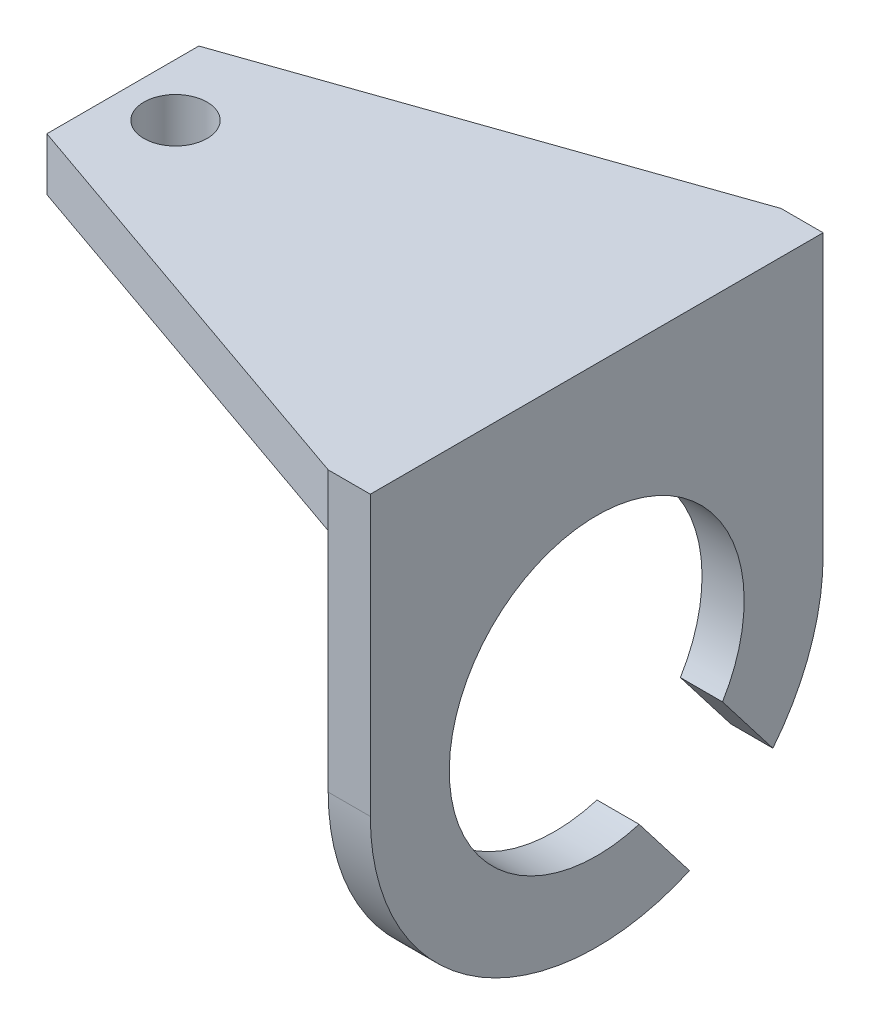
from build123d import *

# Parameters (mm, degrees)
SKETCH1_R                = 21.5
SKETCH1_R_2              = 14
BOSS_EXTRUDE1_DEPTH      = 4
BOSS_EXTRUDE2_REACH      = 50.242
BOSS_EXTRUDE2_END_RADIUS = 21.5
SKETCH2_W                = 4
SKETCH2_H                = 43
SKETCH2_3_W              = 45
SKETCH2_3_H              = 43
SKETCH2_3_R              = 3
BOSS_EXTRUDE3_DEPTH      = 5
CUT_EXTRUDE4_DEPTH       = 64.184254368
WIRE_BREAK_DEPTH         = 54.343228249


with BuildPart() as part:
    # Sketch1 → Boss-Extrude1 (new body)
    with BuildSketch(Plane(origin=(0, 0, 0), x_dir=(0, 0, -1), z_dir=(1, 0, 0))):
        Circle(SKETCH1_R)
        Circle(SKETCH1_R_2, mode=Mode.SUBTRACT)
    extrude(amount=BOSS_EXTRUDE1_DEPTH)

    # Boss-Extrude2: up to this cylinder (the profile starts outside it)
    boss_extrude2_end = Plane(origin=(2, 0, 0), z_dir=(-1, 0, 0)) * Cylinder(BOSS_EXTRUDE2_END_RADIUS, 144.484, mode=Mode.PRIVATE)
    # Sketch2 → Boss-Extrude2 (add, up to the surface)
    with BuildSketch(Plane(origin=(0, 21.5, 0), x_dir=(1, 0, 0), z_dir=(0, 1, 0)), mode=Mode.PRIVATE) as boss_extrude2_sk1:
        with Locations((2, 0)):
            Rectangle(SKETCH2_W, SKETCH2_H)
    boss_extrude2_tool1 = extrude(boss_extrude2_sk1.sketch, amount=-BOSS_EXTRUDE2_REACH, mode=Mode.PRIVATE) - boss_extrude2_end
    add(boss_extrude2_tool1.solids().sort_by_distance((2, 21.5, 0))[0])
    add(boss_extrude2_tool1.solids().sort_by_distance((2, 21.5, 0))[1])

    # Sketch2<3> → Boss-Extrude3 (add)
    with BuildSketch(Plane(origin=(0, 21.5, 0), x_dir=(1, 0, 0), z_dir=(0, 1, 0))):
        with Locations((-18.5, 0)):
            Rectangle(SKETCH2_3_W, SKETCH2_3_H)
        with Locations((-36, 0)):
            Circle(SKETCH2_3_R, mode=Mode.SUBTRACT)
    extrude(amount=BOSS_EXTRUDE3_DEPTH)

    # Sketch3 → Cut-Extrude4 (cut, through all)
    with BuildSketch(Plane.XZ.offset(-21.5)):
        Polygon((-41, -7.216009452), (-41, -28.471778575), (0, -28.471778575), (0, -21.5), align=None)
        Polygon((-41, 27.25128432), (-41, 7.216009452), (0, 21.5), (0, 27.25128432), align=None)
    extrude(amount=-CUT_EXTRUDE4_DEPTH, mode=Mode.SUBTRACT)

    # Sketch4 → wire break (cut, through all)
    with BuildSketch(Plane.ZY):
        Polygon((-3.959672524, 3.053030216), (3.959672524, -3.053030216), (-14.358508771, -26.811065363), (-22.27785382, -20.705004931), align=None)
    extrude(amount=-WIRE_BREAK_DEPTH, mode=Mode.SUBTRACT)


solid = part.part
